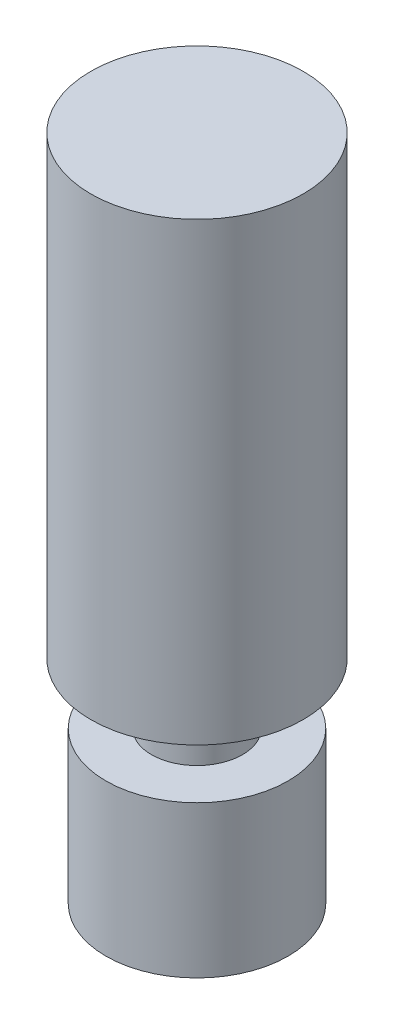
from build123d import *


with BuildPart() as part:
    # Sketch1 → Revolve1 (revolve)
    with BuildSketch(Plane.XY, mode=Mode.PRIVATE) as revolve1_sk:
        Polygon((0, 22), (3.5, 22), (3.5, 7), (1.5, 7), (1.5, 5), (3, 5), (3, 0), (0, 0), align=None)
    revolve(revolve1_sk.sketch.rotate(Axis((0, 0, 0), (0, 1, 0)), 90), axis=Axis((0, 0, 0), (0, 1, 0)))


solid = part.part
